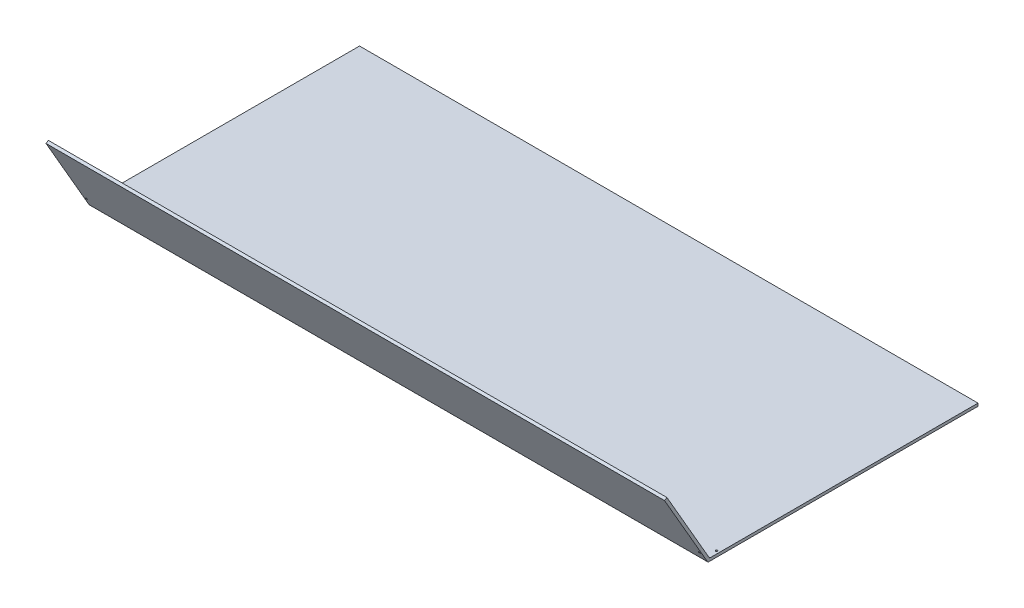
from build123d import *

# Parameters (mm, degrees)
SKETCH1_W           = 1050.036
SKETCH1_H           = 457.2
BOSS_EXTRUDE1_DEPTH = 4.7625
BOSS_EXTRUDE2_DEPTH = 1050.036
SKETCH9_R           = 1.5875
CUT_EXTRUDE3_DEPTH  = 574.601708141
CIRPATTERN1_COUNT   = 2
CIRPATTERN1_ANGLE   = 120
CUT_EXTRUDE2_REACH  = 826.59
SKETCH8_W           = 1050.036
SKETCH8_H           = 311.15
FILLET1_R           = 2.38125


with BuildPart() as part:
    # Sketch1 → Boss-Extrude1 (new body)
    with BuildSketch(Plane(origin=(0, 0, 0), x_dir=(1, 0, 0), z_dir=(0, 1, 0))):
        Rectangle(SKETCH1_W, SKETCH1_H)
    boss_extrude1 = extrude(amount=BOSS_EXTRUDE1_DEPTH)

    # Sketch2 → Boss-Extrude2 (add)
    with BuildSketch(Plane.ZY.offset(525.018)):
        with BuildLine():
            Line((228.6, 4.7625), (228.6, 0))
            ThreePointArc((228.6, 0), (230.98125, 2.38125), (228.6, 4.7625))
        make_face()
    extrude(amount=-BOSS_EXTRUDE2_DEPTH)

    # Sketch9 → Cut-Extrude3 (cut, through all)
    with BuildSketch(Plane(origin=(0, 4.7625, 0), x_dir=(1, 0, 0), z_dir=(0, 1, 0))):
        with Locations(Location((520.2555, -210.3923148, 0), (0, 0, 270))):
            Circle(SKETCH9_R)
        with Locations(Location((-520.2555, -210.3923148, 0), (0, 0, 270))):
            Circle(SKETCH9_R)
    cut_extrude3 = extrude(amount=-CUT_EXTRUDE3_DEPTH, mode=Mode.SUBTRACT)

    # CirPattern1: Boss-Extrude1, Cut-Extrude3 ×2 about axis
    cirpattern1_axis = Axis((0, 2.38125, 228.6), (1, 0, 0))
    add([boss_extrude1.rotate(cirpattern1_axis, i * CIRPATTERN1_ANGLE / (CIRPATTERN1_COUNT - 1)) for i in range(1, CIRPATTERN1_COUNT)])
    add([cut_extrude3.rotate(cirpattern1_axis, i * CIRPATTERN1_ANGLE / (CIRPATTERN1_COUNT - 1)) for i in range(1, CIRPATTERN1_COUNT)], mode=Mode.SUBTRACT)

    # Sketch8 → Cut-Extrude2 (cut, up to next)
    with BuildSketch(Plane(origin=(0, -97.200766153, 168.356665511), x_dir=(-1, 0, 0), z_dir=(0, 0.500000000000004, -0.8660254037844365)), mode=Mode.PRIVATE) as cut_extrude2_sk1:
        with Locations((0, 417.987222993)):
            Rectangle(SKETCH8_W, SKETCH8_H)
    cut_extrude2_tool1 = extrude(cut_extrude2_sk1.sketch, amount=-CUT_EXTRUDE2_REACH, mode=Mode.PRIVATE) & part.part
    add(cut_extrude2_tool1.solids().sort_by_distance((0, 264.786787, 377.350277))[0], mode=Mode.SUBTRACT)

    # Fillet1
    fillet1_edges = [part.edges().sort_by_distance(p)[0] for p in [
        (0, 4.7625, 227.225184671),
    ]]
    fillet(fillet1_edges, radius=FILLET1_R)


solid = part.part
